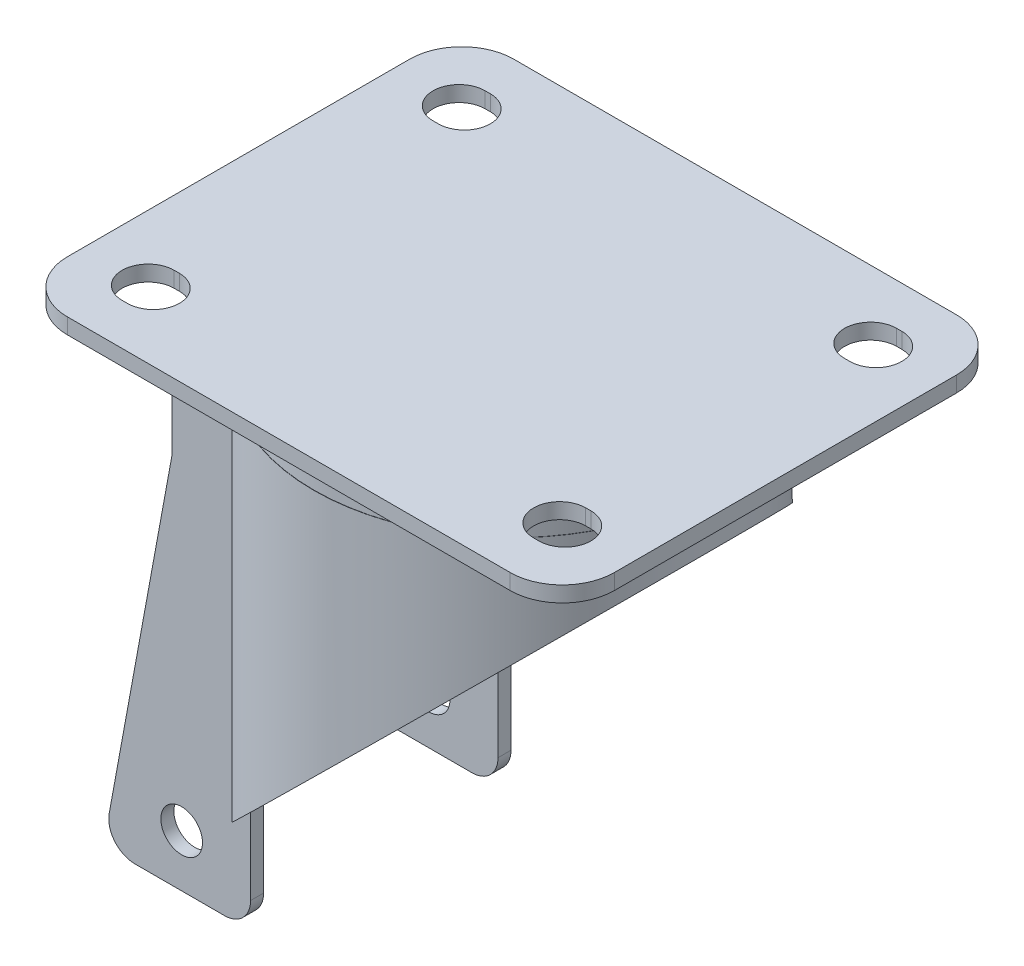
from build123d import *

# Parameters (mm, degrees)
EXTRUDE_1_DEPTH      = 3
SKETCH_2_R           = 38
EXTRUDE_2_DEPTH      = 7
SKETCH_3_R           = 38.05
SKETCH_3_R_2         = 35.5
EXTRUDE_1_2_DEPTH    = 85
CUT_EXTRUDE_3_DEPTH  = 43.5
SKETCH_5_W           = 50
SKETCH_5_H           = 94
CUT_EXTRUDE_4_DEPTH  = 47
EXTRUDE_5_DEPTH      = 2.5
FILLET_1_R           = 1
EXTRUDE_START        = -2.5
EXTRUDE_11_DEPTH     = 2.5
EXTRUDE_13_DEPTH     = 2.5
SKETCH_11_R          = 4
CUT_EXTRUDE_14_DEPTH = 36.25


with BuildPart() as part:
    # Эскиз1 → Extrude 1 (new body)
    with BuildSketch(Plane(origin=(0, 0, 0), x_dir=(1, 0, 0), z_dir=(0, 1, 0))):
        with BuildLine():
            Line((-42.503420423, 42.846855414), (42.503420423, 42.846855414))
            ThreePointArc((42.503420423, 42.846855414), (49.574488235, 39.917923226), (52.503420423, 32.846855414))
            Line((52.503420423, 32.846855414), (52.503420423, -32.846855414))
            ThreePointArc((52.503420423, -32.846855414), (49.574488235, -39.917923226), (42.503420423, -42.846855414))
            Line((42.503420423, -42.846855414), (-42.503420423, -42.846855414))
            ThreePointArc((-42.503420423, -42.846855414), (-49.574488235, -39.917923226), (-52.503420423, -32.846855414))
            Line((-52.503420423, -32.846855414), (-52.503420423, 32.846855414))
            ThreePointArc((-52.503420423, 32.846855414), (-49.574488235, 39.917923226), (-42.503420423, 42.846855414))
        make_face()
        with BuildLine():
            Line((40.003420423, 24.846855414), (39.003420423, 24.846855414))
            ThreePointArc((39.003420423, 24.846855414), (34.003420423, 29.846855414), (39.003420423, 34.846855414))
            Line((39.003420423, 34.846855414), (40.003420423, 34.846855414))
            ThreePointArc((40.003420423, 34.846855414), (45.003420423, 29.846855414), (40.003420423, 24.846855414))
        make_face(mode=Mode.SUBTRACT)
        with BuildLine():
            Line((-40.003420423, 24.846855414), (-39.003420423, 24.846855414))
            ThreePointArc((-39.003420423, 24.846855414), (-34.003420423, 29.846855414), (-39.003420423, 34.846855414))
            Line((-39.003420423, 34.846855414), (-40.003420423, 34.846855414))
            ThreePointArc((-40.003420423, 34.846855414), (-45.003420423, 29.846855414), (-40.003420423, 24.846855414))
        make_face(mode=Mode.SUBTRACT)
        with BuildLine():
            Line((40.003420423, -24.846855414), (39.003420423, -24.846855414))
            ThreePointArc((39.003420423, -24.846855414), (34.003420423, -29.846855414), (39.003420423, -34.846855414))
            Line((39.003420423, -34.846855414), (40.003420423, -34.846855414))
            ThreePointArc((40.003420423, -34.846855414), (45.003420423, -29.846855414), (40.003420423, -24.846855414))
        make_face(mode=Mode.SUBTRACT)
        with BuildLine():
            Line((-40.003420423, -24.846855414), (-39.003420423, -24.846855414))
            ThreePointArc((-39.003420423, -24.846855414), (-34.003420423, -29.846855414), (-39.003420423, -34.846855414))
            Line((-39.003420423, -34.846855414), (-40.003420423, -34.846855414))
            ThreePointArc((-40.003420423, -34.846855414), (-45.003420423, -29.846855414), (-40.003420423, -24.846855414))
        make_face(mode=Mode.SUBTRACT)
    extrude(amount=EXTRUDE_1_DEPTH)

    # Эскиз2 → Вытянуть2 (add)
    with BuildSketch(Plane.XZ):
        with Locations(Location((0, 0, 0), (0, 0, 90))):
            Circle(SKETCH_2_R)
    extrude(amount=EXTRUDE_2_DEPTH)

    # Эскиз3 → Extrude 1 2 (add)
    with BuildSketch(Plane.XZ.offset(7)):
        Circle(SKETCH_3_R)
        Circle(SKETCH_3_R_2, mode=Mode.SUBTRACT)
    extrude(amount=EXTRUDE_1_2_DEPTH)

    # Эскиз4 → Вытянуть3 (cut, symmetric)
    with BuildSketch(Plane.XY):
        Polygon((46.057165953, -9.180691219), (-39.336892278, -93.475255138), (46.057165953, -93.475255138), align=None)
    extrude(amount=CUT_EXTRUDE_3_DEPTH, both=True, mode=Mode.SUBTRACT)

    # Эскиз5 → Вытянуть4 (cut)
    with BuildSketch(Plane(origin=(0, 0, 0), x_dir=(0, 0, -1), z_dir=(1, 0, 0))):
        with Locations((-0.75, -58.382287581)):
            Rectangle(SKETCH_5_W, SKETCH_5_H)
    extrude(amount=-CUT_EXTRUDE_4_DEPTH, mode=Mode.SUBTRACT)

    # Эскиз6 → Вытянуть5 (add)
    with BuildSketch(Plane.XZ.offset(11.382287581)):
        with BuildLine():
            Line((-38.608269391, 25.75), (-24.437420077, 25.75))
            ThreePointArc((-24.437420077, 25.75), (-35.484265547, 1.056834232), (-25.926579026, -24.25))
            Line((-25.926579026, -24.25), (-39.571539531, -24.25))
            ThreePointArc((-39.571539531, -24.25), (-46.425945172, 0.891331779), (-38.608269391, 25.75))
        make_face()
    extrude(amount=EXTRUDE_5_DEPTH)

    # Скругление1
    fillet_1_edges = [part.edges().sort_by_distance(p)[0] for p in [
        (-38.036984774, -11.382287581, 0.995132823),
    ]]
    fillet(fillet_1_edges, radius=FILLET_1_R)


with BuildPart() as body_2:
    # Эскиз8 → Вытянуть11 (new body)
    with BuildSketch(Plane(origin=(0, 0, -24.25), x_dir=(-1, 0, 0), z_dir=(0, 0, -1)).offset(EXTRUDE_START)):
        with BuildLine():
            Line((24.437420077, -13.882287581), (24.437420077, -93.562403085))
            ThreePointArc((24.437420077, -93.562403085), (25.901886171, -97.097936991), (29.437420077, -98.562403085))
            Line((29.437420077, -98.562403085), (46.667802969, -98.562403085))
            ThreePointArc((46.667802969, -98.562403085), (50.509723502, -96.762347868), (51.585376396, -92.658261731))
            Line((51.585376396, -92.658261731), (39.571539531, -27.315685955))
            Line((39.571539531, -27.315685955), (39.571539531, -13.882287581))
            Line((39.571539531, -13.882287581), (24.437420077, -13.882287581))
        make_face()
    extrude(amount=EXTRUDE_11_DEPTH)


with BuildPart() as body_3:
    # Эскиз10 → Вытянуть13 (new body)
    with BuildSketch(Plane.XY.offset(25.75).offset(EXTRUDE_START)):
        with BuildLine():
            Line((-24.437420077, -13.882287581), (-24.437420077, -93.562403085))
            ThreePointArc((-24.437420077, -93.562403085), (-25.897661253, -97.10563805), (-29.437405876, -98.574319881))
            Line((-29.437405876, -98.574319881), (-46.669993982, -98.574319881))
            ThreePointArc((-46.669993982, -98.574319881), (-50.511914515, -96.774264664), (-51.587567409, -92.670178527))
            Line((-51.587567409, -92.670178527), (-39.571539531, -27.315685955))
            Line((-39.571539531, -27.315685955), (-39.571539531, -13.882287581))
            Line((-39.571539531, -13.882287581), (-24.437420077, -13.882287581))
        make_face()
    extrude(amount=EXTRUDE_13_DEPTH)


with BuildPart() as cut_extrude_14_tool:
    # Эскиз11 → Вытянуть14 (new, symmetric)
    with BuildSketch(Plane.XY):
        with Locations(Location((-37.669993982, -88.574319881, 0), (0, 0, 180))):
            Circle(SKETCH_11_R)
    extrude(amount=CUT_EXTRUDE_14_DEPTH, both=True)


with BuildPart() as body_2_1:
    add(body_2.part)

    # Вытянуть14: cut by cut_extrude_14_tool
    add(cut_extrude_14_tool.part, mode=Mode.SUBTRACT)


with BuildPart() as body_3_1:
    add(body_3.part)

    # Вытянуть14: cut by cut_extrude_14_tool
    add(cut_extrude_14_tool.part, mode=Mode.SUBTRACT)


solid = Compound([part.part, body_2_1.part, body_3_1.part])
